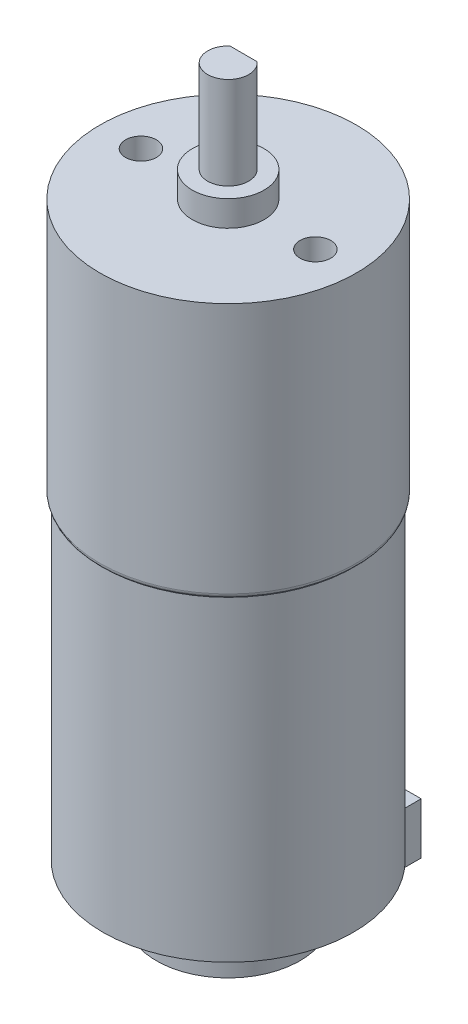
from build123d import *

# Parameters (mm, degrees)
SKETCH1_R           = 12.5
BOSS_EXTRUDE1_DEPTH = 25
FILLET1_R           = 0.5
SKETCH3_R           = 12.2
BOSS_EXTRUDE2_DEPTH = 30.8
SKETCH4_R           = 3.5
BOSS_EXTRUDE3_DEPTH = 2.5
SKETCH5_R           = 2
BOSS_EXTRUDE4_DEPTH = 9
CUT_EXTRUDE1_START  = -8
CUT_EXTRUDE1_DEPTH  = 8
SKETCH7_R           = 1.5
CUT_EXTRUDE2_DEPTH  = 5
SKETCH8_R           = 7
SKETCH8_W           = 8.453145494
SKETCH8_H           = 4.159745146
BOSS_EXTRUDE5_DEPTH = 5


with BuildPart() as part:
    # Sketch1 → Boss-Extrude1 (new body)
    with BuildSketch(Plane(origin=(0, 0, 0), x_dir=(1, 0, 0), z_dir=(0, 1, 0))):
        with Locations(Location((0, 0, 0), (0, 0, 270))):
            Circle(SKETCH1_R)
    extrude(amount=BOSS_EXTRUDE1_DEPTH)

    # Fillet1
    fillet1_edges = [part.edges().sort_by_distance(p)[0] for p in [
        (0, 0, -12.5),
    ]]
    fillet(fillet1_edges, radius=FILLET1_R)

    # Sketch3 → Boss-Extrude2 (add)
    with BuildSketch(Plane.XZ):
        with Locations(Location((0, 0, 0), (0, 0, 90))):
            Circle(SKETCH3_R)
    extrude(amount=BOSS_EXTRUDE2_DEPTH)

    # Sketch4 → Boss-Extrude3 (add)
    with BuildSketch(Plane(origin=(0, 25, 0), x_dir=(1, 0, 0), z_dir=(0, 1, 0))):
        with Locations(Location((0, 0, 0), (0, 0, 270))):
            Circle(SKETCH4_R)
    extrude(amount=BOSS_EXTRUDE3_DEPTH)

    # Sketch5 → Boss-Extrude4 (add)
    with BuildSketch(Plane(origin=(0, 27.5, 0), x_dir=(1, 0, 0), z_dir=(0, 1, 0))):
        with Locations(Location((0, 0, 0), (0, 0, 270))):
            Circle(SKETCH5_R)
    extrude(amount=BOSS_EXTRUDE4_DEPTH)

    # Sketch6 → Cut-Extrude1 (cut)
    with BuildSketch(Plane(origin=(0, 36.5, 0), x_dir=(1, 0, 0), z_dir=(0, 1, 0)).offset(CUT_EXTRUDE1_START)):
        with BuildLine():
            Line((1.322875656, 1.5), (-1.322875656, 1.5))
            ThreePointArc((-1.322875656, 1.5), (0, 2), (1.322875656, 1.5))
        make_face()
    extrude(amount=CUT_EXTRUDE1_DEPTH, mode=Mode.SUBTRACT)

    # Sketch7 → Cut-Extrude2 (cut)
    with BuildSketch(Plane(origin=(0, 25, 0), x_dir=(1, 0, 0), z_dir=(0, 1, 0))):
        with Locations(Location((-8.5, 0, 0), (0, 0, 270))):
            Circle(SKETCH7_R)
        with Locations(Location((8.5, 0, 0), (0, 0, 270))):
            Circle(SKETCH7_R)
    extrude(amount=-CUT_EXTRUDE2_DEPTH, mode=Mode.SUBTRACT)

    # Sketch8 → Boss-Extrude5 (add)
    with BuildSketch(Plane.XZ.offset(30.8)):
        with Locations(Location((0, 0, 0), (0, 0, 270))):
            Circle(SKETCH8_R)
        with Locations((0, -12.5)):
            Rectangle(SKETCH8_W, SKETCH8_H)
    extrude(amount=BOSS_EXTRUDE5_DEPTH)


solid = part.part
